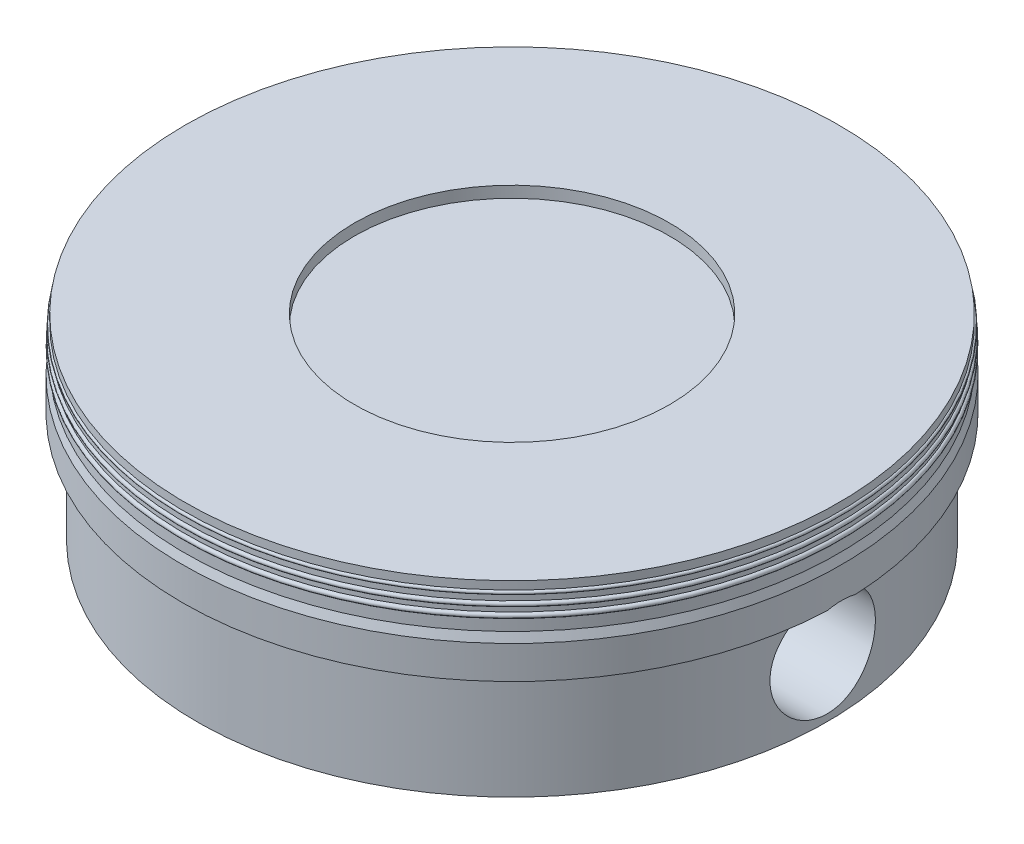
from build123d import *

# Parameters (mm, degrees)
BOSS_EXTRUDE2_START     = -63.5
BOSS_EXTRUDE2_DEPTH     = 63.5
CUT_EXTRUDE1_DEPTH      = 195.824431028
CUT_EXTRUDE1_DEPTH_BACK = 195.824431028
SKETCH3_R               = 20.32


with BuildPart() as part:
    # Sketch1 → Revolve1 (revolve)
    with BuildSketch(Plane.XY, mode=Mode.PRIVATE) as revolve1_sk:
        with BuildLine():
            Line((121.412, 0), (87.122, 0))
            Line((87.122, 0), (87.122, 49.022))
            Line((87.122, 49.022), (106.68, 49.022))
            Line((106.68, 49.022), (106.68, 59.182))
            Line((106.68, 59.182), (0, 59.182))
            Line((0, 59.182), (0, 71.12))
            Line((0, 71.12), (60.706, 71.12))
            Line((60.706, 71.12), (60.706, 75.4888))
            Line((60.706, 75.4888), (125.984, 75.4888))
            Line((125.984, 75.4888), (125.984, 72.365536076))
            ThreePointArc((125.984, 72.365536076), (126.670736076, 71.6788), (125.984, 70.992063924))
            Line((125.984, 70.992063924), (125.984, 68.761950168))
            ThreePointArc((125.984, 68.761950168), (126.877150168, 67.8688), (125.984, 66.975649832))
            Line((125.984, 66.975649832), (125.984, 65.043296749))
            ThreePointArc((125.984, 65.043296749), (126.968496749, 64.0588), (125.984, 63.074303251))
            Line((125.984, 63.074303251), (125.984, 58.54164751))
            Line((125.984, 58.54164751), (127, 55.245))
            Line((127, 55.245), (127, 42.545))
            Line((127, 42.545), (121.412, 42.545))
            Line((121.412, 42.545), (121.412, 0))
        make_face()
    revolve(revolve1_sk.sketch.rotate(Axis((0, 76.2, 0), (0, -1, 0)), 180), axis=Axis((0, 76.2, 0), (0, -1, 0)))

    # Sketch2 → Boss-Extrude2 (add)
    with BuildSketch(Plane.XZ.offset(BOSS_EXTRUDE2_START)):
        with BuildLine():
            Line((-44.45, 74.92956949), (-44.45, -74.92956949))
            ThreePointArc((-44.45, -74.92956949), (-87.122, 0), (-44.45, 74.92956949))
        make_face()
        with BuildLine():
            Line((44.45, 74.92956949), (44.45, -74.92956949))
            ThreePointArc((44.45, -74.92956949), (87.122, 0), (44.45, 74.92956949))
        make_face()
    extrude(amount=BOSS_EXTRUDE2_DEPTH)

    # Sketch3 → Cut-Extrude1 (cut, two sides: drawn at the far end of the back side and taken through both)
    with BuildSketch(Plane(origin=(0, 0, 0), x_dir=(0, 0, -1), z_dir=(1, 0, 0)).offset(-CUT_EXTRUDE1_DEPTH_BACK)):
        with Locations(Location((0, 22.987, 0), (0, 0, 74.259451475))):
            Circle(SKETCH3_R)
    extrude(amount=CUT_EXTRUDE1_DEPTH + CUT_EXTRUDE1_DEPTH_BACK, mode=Mode.SUBTRACT)


solid = part.part
